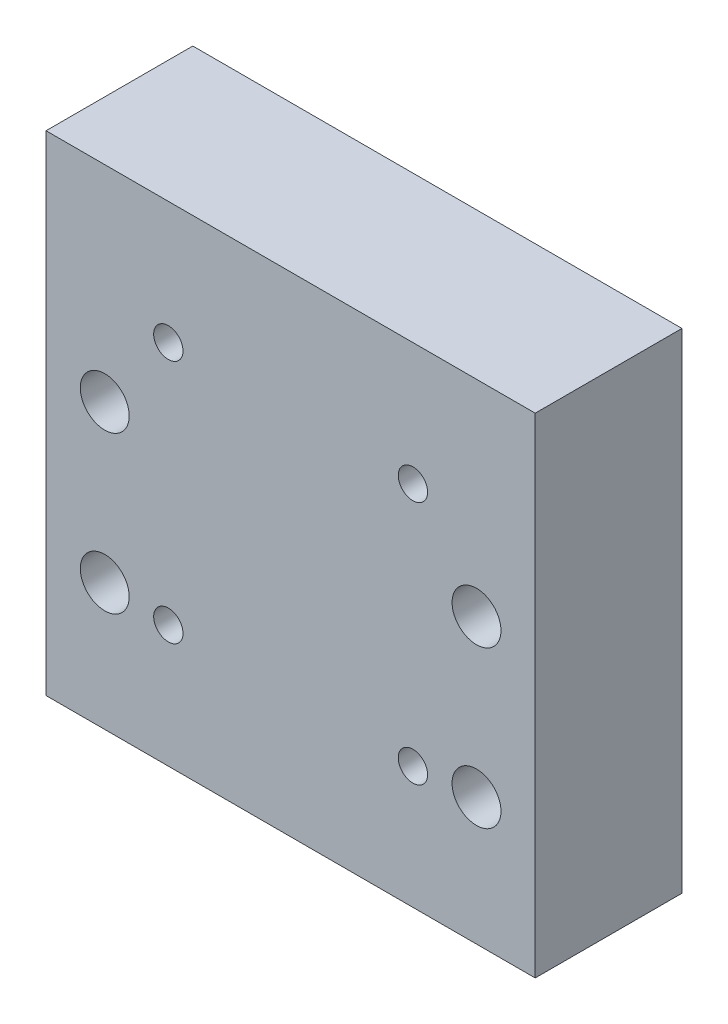
from build123d import *

# Parameters (mm, degrees)
SKETCH1_W           = 50
SKETCH1_H           = 50
BOSS_EXTRUDE1_DEPTH = 15
CUT_EXTRUDE1_REACH  = 40.406
SKETCH2_R           = 1.5
SKETCH3_R           = 2.5
CUT_EXTRUDE2_DEPTH  = 5
CUT_EXTRUDE3_REACH  = 40.406
SKETCH4_R           = 1.5


with BuildPart() as part:
    # Sketch1 → Boss-Extrude1 (new body)
    with BuildSketch(Plane.XY):
        Rectangle(SKETCH1_W, SKETCH1_H)
    extrude(amount=BOSS_EXTRUDE1_DEPTH)

    # Sketch2 → Cut-Extrude1 (cut, up to next)
    with BuildSketch(Plane(origin=(0, 0, 0), x_dir=(-1, 0, 0), z_dir=(0, 0, -1)), mode=Mode.PRIVATE) as cut_extrude1_sk1:
        with Locations((-19, 4)):
            Circle(SKETCH2_R)
    cut_extrude1_tool1 = extrude(cut_extrude1_sk1.sketch, amount=-CUT_EXTRUDE1_REACH, mode=Mode.PRIVATE) & part.part
    # Sketch2 → Cut-Extrude1 (cut, up to next)
    with BuildSketch(Plane(origin=(0, 0, 0), x_dir=(-1, 0, 0), z_dir=(0, 0, -1)), mode=Mode.PRIVATE) as cut_extrude1_sk2:
        with Locations((-19, -12)):
            Circle(SKETCH2_R)
    cut_extrude1_tool2 = extrude(cut_extrude1_sk2.sketch, amount=-CUT_EXTRUDE1_REACH, mode=Mode.PRIVATE) & part.part
    # Sketch2 → Cut-Extrude1 (cut, up to next)
    with BuildSketch(Plane(origin=(0, 0, 0), x_dir=(-1, 0, 0), z_dir=(0, 0, -1)), mode=Mode.PRIVATE) as cut_extrude1_sk3:
        with Locations((19, -12)):
            Circle(SKETCH2_R)
    cut_extrude1_tool3 = extrude(cut_extrude1_sk3.sketch, amount=-CUT_EXTRUDE1_REACH, mode=Mode.PRIVATE) & part.part
    # Sketch2 → Cut-Extrude1 (cut, up to next)
    with BuildSketch(Plane(origin=(0, 0, 0), x_dir=(-1, 0, 0), z_dir=(0, 0, -1)), mode=Mode.PRIVATE) as cut_extrude1_sk4:
        with Locations((19, 4)):
            Circle(SKETCH2_R)
    cut_extrude1_tool4 = extrude(cut_extrude1_sk4.sketch, amount=-CUT_EXTRUDE1_REACH, mode=Mode.PRIVATE) & part.part
    add(cut_extrude1_tool1.solids().sort_by_distance((19, 4, 0))[0], mode=Mode.SUBTRACT)
    add(cut_extrude1_tool2.solids().sort_by_distance((19, -12, 0))[0], mode=Mode.SUBTRACT)
    add(cut_extrude1_tool3.solids().sort_by_distance((-19, -12, 0))[0], mode=Mode.SUBTRACT)
    add(cut_extrude1_tool4.solids().sort_by_distance((-19, 4, 0))[0], mode=Mode.SUBTRACT)

    # Sketch3 → Cut-Extrude2 (cut)
    with BuildSketch(Plane.XY.offset(15)):
        with Locations((-19, 4)):
            Circle(SKETCH3_R)
        with Locations((-19, -12)):
            Circle(SKETCH3_R)
        with Locations((19, 4)):
            Circle(SKETCH3_R)
        with Locations((19, -12)):
            Circle(SKETCH3_R)
    extrude(amount=-CUT_EXTRUDE2_DEPTH, mode=Mode.SUBTRACT)

    # Sketch4 → Cut-Extrude3 (cut, up to next)
    with BuildSketch(Plane.XY.offset(15), mode=Mode.PRIVATE) as cut_extrude3_sk1:
        with Locations((-12.5, -12.5)):
            Circle(SKETCH4_R)
    cut_extrude3_tool1 = extrude(cut_extrude3_sk1.sketch, amount=-CUT_EXTRUDE3_REACH, mode=Mode.PRIVATE) & part.part
    # Sketch4 → Cut-Extrude3 (cut, up to next)
    with BuildSketch(Plane.XY.offset(15), mode=Mode.PRIVATE) as cut_extrude3_sk2:
        with Locations((-12.5, 12.5)):
            Circle(SKETCH4_R)
    cut_extrude3_tool2 = extrude(cut_extrude3_sk2.sketch, amount=-CUT_EXTRUDE3_REACH, mode=Mode.PRIVATE) & part.part
    # Sketch4 → Cut-Extrude3 (cut, up to next)
    with BuildSketch(Plane.XY.offset(15), mode=Mode.PRIVATE) as cut_extrude3_sk3:
        with Locations((12.5, -12.5)):
            Circle(SKETCH4_R)
    cut_extrude3_tool3 = extrude(cut_extrude3_sk3.sketch, amount=-CUT_EXTRUDE3_REACH, mode=Mode.PRIVATE) & part.part
    # Sketch4 → Cut-Extrude3 (cut, up to next)
    with BuildSketch(Plane.XY.offset(15), mode=Mode.PRIVATE) as cut_extrude3_sk4:
        with Locations((12.5, 12.5)):
            Circle(SKETCH4_R)
    cut_extrude3_tool4 = extrude(cut_extrude3_sk4.sketch, amount=-CUT_EXTRUDE3_REACH, mode=Mode.PRIVATE) & part.part
    add(cut_extrude3_tool1.solids().sort_by_distance((-12.5, -12.5, 15))[0], mode=Mode.SUBTRACT)
    add(cut_extrude3_tool2.solids().sort_by_distance((-12.5, 12.5, 15))[0], mode=Mode.SUBTRACT)
    add(cut_extrude3_tool3.solids().sort_by_distance((12.5, -12.5, 15))[0], mode=Mode.SUBTRACT)
    add(cut_extrude3_tool4.solids().sort_by_distance((12.5, 12.5, 15))[0], mode=Mode.SUBTRACT)


solid = part.part
